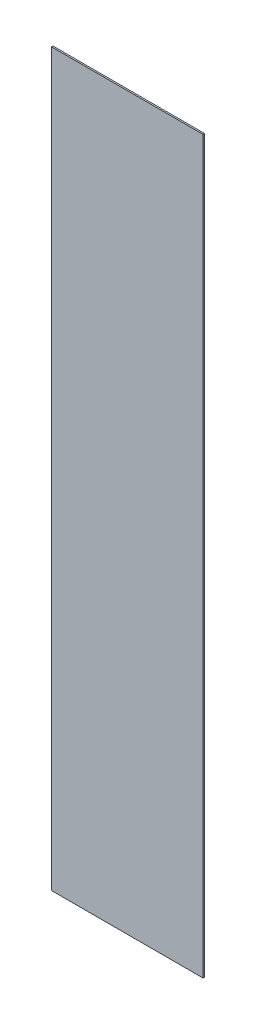
from build123d import *

# Parameters (mm, degrees)
SKETCH1_W           = 1000
SKETCH1_H           = 4825.05
BOSS_EXTRUDE1_DEPTH = 10


with BuildPart() as part:
    # Sketch1 → Boss-Extrude1 (new body)
    with BuildSketch(Plane.XY):
        Rectangle(SKETCH1_W, SKETCH1_H)
    extrude(amount=BOSS_EXTRUDE1_DEPTH)


solid = part.part
